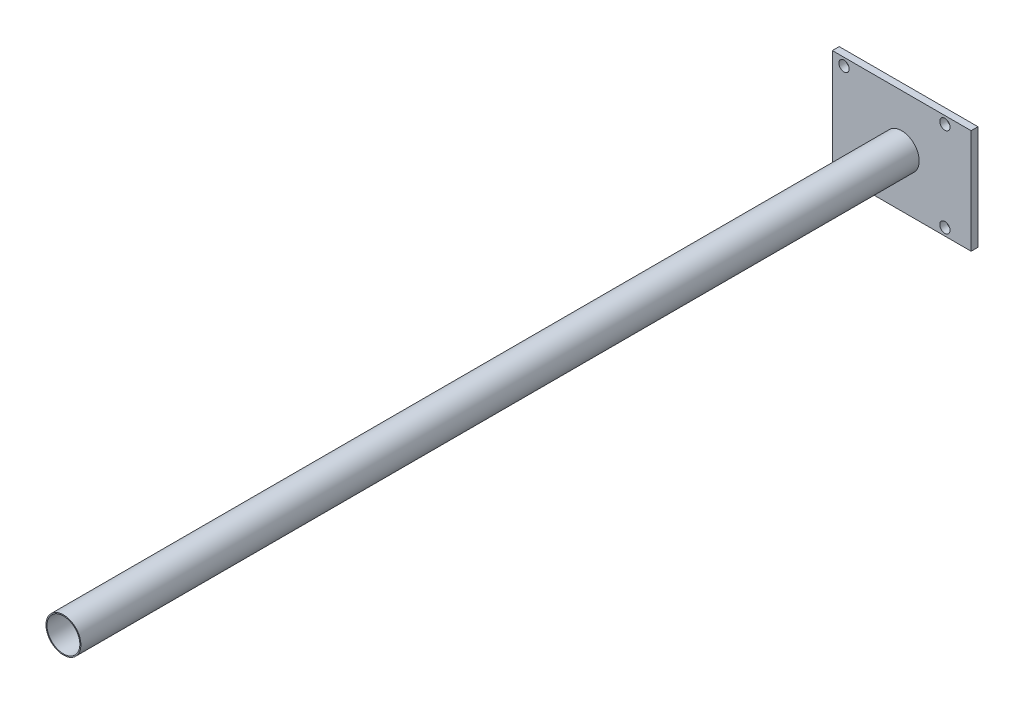
from build123d import *

# Parameters (mm, degrees)
SKETCH1_W           = 202
SKETCH1_H           = 152
SKETCH1_R           = 7.5
BOSS_EXTRUDE1_DEPTH = 10
SKETCH2_R           = 25.4
SKETCH2_R_2         = 23.9
BOSS_EXTRUDE2_DEPTH = 1220


with BuildPart() as part:
    # Sketch1 → Boss-Extrude1 (new body)
    with BuildSketch(Plane.XY):
        with Locations((-101, 76)):
            Rectangle(SKETCH1_W, SKETCH1_H)
        with Locations((-185, 141)):
            Circle(SKETCH1_R, mode=Mode.SUBTRACT)
        with Locations((-185, 11)):
            Circle(SKETCH1_R, mode=Mode.SUBTRACT)
        with Locations((-38.177870513, 141)):
            Circle(SKETCH1_R, mode=Mode.SUBTRACT)
        with Locations((-38.177870513, 11)):
            Circle(SKETCH1_R, mode=Mode.SUBTRACT)
    extrude(amount=BOSS_EXTRUDE1_DEPTH)

    # Sketch2 → Boss-Extrude2 (add)
    with BuildSketch(Plane.XY.offset(10)):
        with Locations((-101, 76)):
            Circle(SKETCH2_R)
        with Locations((-101, 76)):
            Circle(SKETCH2_R_2, mode=Mode.SUBTRACT)
    extrude(amount=BOSS_EXTRUDE2_DEPTH)


solid = part.part
